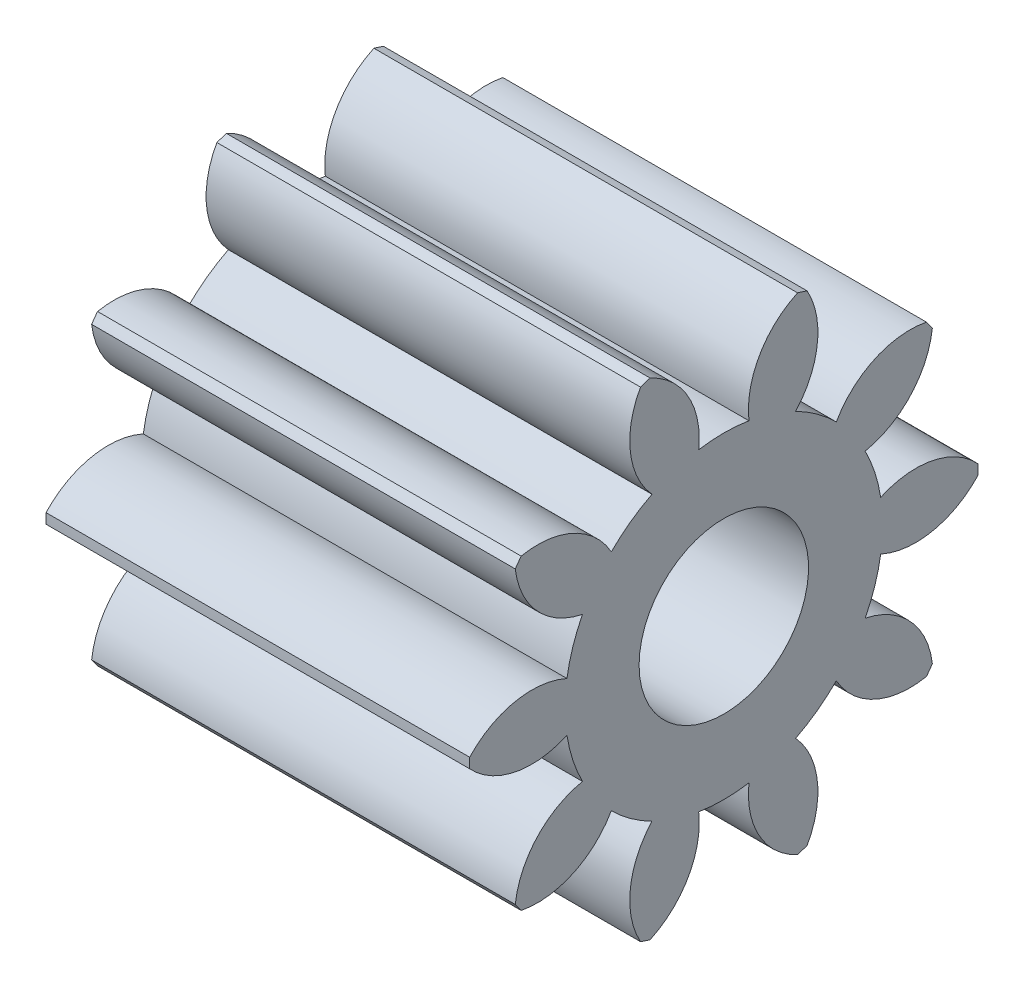
from build123d import *

# Parameters (mm, degrees)
BASPROSKE_W     = 5
BASPROSKE_H     = 3
TOOTHCUT_DEPTH  = 7.557438524
TEETHCUTS_COUNT = 10
TEETHCUTS_ANGLE = 324
BORSKE_R        = 1
BORE_DEPTH      = 50.0002032


with BuildPart() as part:
    # BasProSke → Base-Revolve (revolve)
    with BuildSketch(Plane(origin=(0, 0, 0), x_dir=(1, 0, 0), z_dir=(0, 1, 0)), mode=Mode.PRIVATE) as base_revolve_sk:
        with Locations((2.5, 1.5)):
            Rectangle(BASPROSKE_W, BASPROSKE_H)
    revolve(base_revolve_sk.sketch.rotate(Axis((-10, 0, 0), (1, 0, 0)), 180), axis=Axis((-10, 0, 0), (1, 0, 0)))

    # TooCutSke → ToothCut (cut, through all)
    with BuildSketch(Plane(origin=(0, 0, 0), x_dir=(0, 0, -1), z_dir=(1, 0, 0))):
        with BuildLine():
            ThreePointArc((0.296449938, 1.850403587), (0, 1.874), (-0.296449938, 1.850403587))
            ThreePointArc((-0.296449938, 1.850403587), (-0.428089565, 2.470295585), (-0.905889751, 2.886591228))
            ThreePointArc((-0.905889751, 2.886591228), (0, 3.0254), (0.905889751, 2.886591228))
            ThreePointArc((0.905889751, 2.886591228), (0.428089565, 2.470295585), (0.296449938, 1.850403587))
        make_face()
    toothcut = extrude(amount=TOOTHCUT_DEPTH, mode=Mode.SUBTRACT)

    # TeethCuts: ToothCut ×10 about axis
    teethcuts_axis = Axis((-10, 0, 0), (1, 0, 0))
    for i in range(1, TEETHCUTS_COUNT):
        add(toothcut.rotate(teethcuts_axis, i * TEETHCUTS_ANGLE / (TEETHCUTS_COUNT - 1)), mode=Mode.SUBTRACT)

    # BorSke → Bore (cut, symmetric)
    with BuildSketch(Plane(origin=(0, 0, 0), x_dir=(0, 0, -1), z_dir=(1, 0, 0))):
        with Locations(Location((0, 0, 0), (0, 0, 180))):
            Circle(BORSKE_R)
    extrude(amount=BORE_DEPTH, both=True, mode=Mode.SUBTRACT)


solid = part.part
